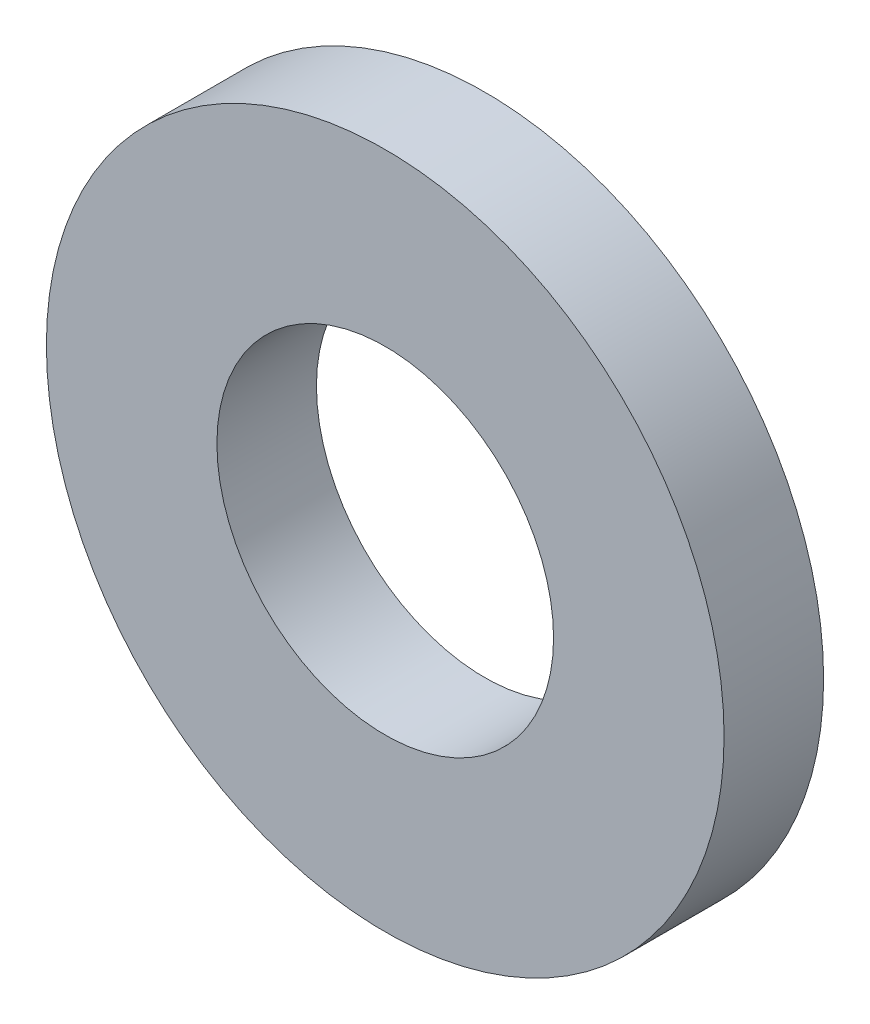
from build123d import *

# Parameters (mm, degrees)
SCHIZZO1_R                   = 2.315
SCHIZZO1_R_2                 = 1.15
ESTRUSIONE_ESTRUSIONE1_DEPTH = 0.68


with BuildPart() as part:
    # Schizzo1 → Estrusione-Estrusione1 (new body)
    with BuildSketch(Plane.XY):
        Circle(SCHIZZO1_R)
        Circle(SCHIZZO1_R_2, mode=Mode.SUBTRACT)
    extrude(amount=ESTRUSIONE_ESTRUSIONE1_DEPTH)


solid = part.part
